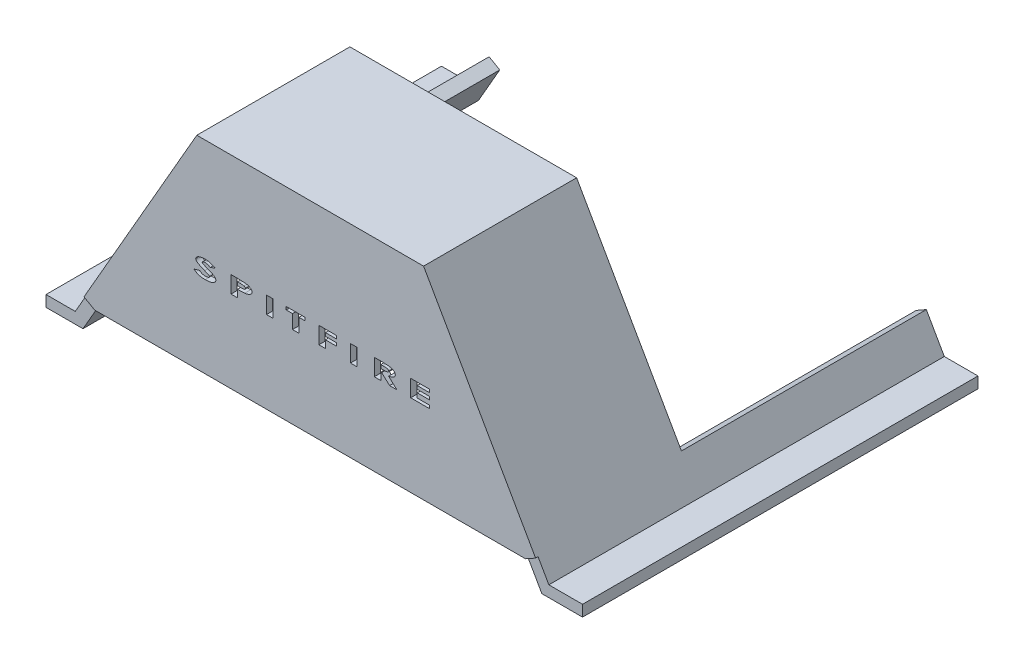
from build123d import *

# Parameters (mm, degrees)
BOSS_EXTRUDE1_DEPTH      = 30.48
BOSS_EXTRUDE4_DEPTH      = 1.27
BOSS_EXTRUDE5_DEPTH      = 50.8
BOSS_EXTRUDE5_DEPTH_BACK = 31.242
SKETCH9_W                = 1.346153846
SKETCH9_H                = 3.5
CUT_EXTRUDE3_DEPTH       = 50.8


with BuildPart() as part:
    # Sketch1 → Boss-Extrude1 (new body)
    with BuildSketch(Plane.XY):
        Polygon((-44.853816772, -1.588616625), (-47.056176074, -0.323225973), (-23.646449013, 40.420421126), (23.390422723, 40.420421126), (46.634567898, -0.417916439), (44.533134042, -1.588616625), (21.917209006, 38.145982087), (-22.076785037, 38.053850823), align=None)
    extrude(amount=BOSS_EXTRUDE1_DEPTH)

    # Sketch7 → Boss-Extrude4 (add)
    with BuildSketch(Plane.XY.offset(30.48)):
        Polygon((-23.646449013, 40.420421126), (-47.056176074, -0.323225973), (-44.853816772, -1.588616625), (44.533134042, -1.588616625), (46.634567898, -0.417916439), (23.390422723, 40.420421126), align=None)
    extrude(amount=BOSS_EXTRUDE4_DEPTH)

    # Sketch8 → Boss-Extrude5 (add, two sides: drawn at the far end of the back side and taken through both)
    with BuildSketch(Plane(origin=(0, 0, 0), x_dir=(-1, 0, 0), z_dir=(0, 0, -1)).offset(-BOSS_EXTRUDE5_DEPTH_BACK)):
        Polygon((-43.047620869, 1.021326136), (-47.422678524, -6.665344208), (-55.860841837, -6.665344208), (-55.860841837, -4.351490918), (-48.873458649, -4.351490918), (-45.138142651, 2.211198072), align=None)
        Polygon((43.354244396, 1.021326136), (47.770708497, -6.665344208), (55.445633406, -6.665344208), (55.445633406, -4.351490918), (49.370661635, -4.351490918), (45.556603699, 2.286716788), align=None)
    extrude(amount=BOSS_EXTRUDE5_DEPTH + BOSS_EXTRUDE5_DEPTH_BACK)

    # Sketch9 → Cut-Extrude3 (cut)
    # profile 1 of 8: a face of its own
    with BuildSketch(Plane.XY.offset(31.75)):
        with BuildLine():
            Line((-19.880975332, 18.460355703), (-20.870258184, 18.030568043))
            add(Edge.make_bspline(
                [(-20.870258184, 18.030568043), (-20.913350949, 18.059220564), (-20.99810049, 18.115570814), (-21.129718016, 18.188377739), (-21.26172595, 18.250504339), (-21.394406873, 18.301041619), (-21.527688025, 18.34085139), (-21.661617608, 18.368660986), (-21.796201846, 18.386318609), (-21.886130388, 18.388468429), (-21.93105546, 18.389542402)],
                knots=[0, 0, 0, 0, 1.091683427, 2.14698847, 3.170740019, 4.168220952, 5.140410702, 6.102843859, 7.052248899, 8, 8, 8, 8], degree=3))
            add(Edge.make_bspline(
                [(-21.93105546, 18.389542402), (-21.972926765, 18.388864571), (-22.052931094, 18.387569425), (-22.167058029, 18.374335419), (-22.269331205, 18.352195427), (-22.358122668, 18.322248083), (-22.430465051, 18.286699348), (-22.484700319, 18.249356661), (-22.520965181, 18.207154752), (-22.52607062, 18.17501169), (-22.528411229, 18.160275575)],
                knots=[0, 0, 0, 0, 1.475665859, 2.819583916, 4.043032172, 5.158235078, 6.116265948, 6.87105205, 7.482429282, 8, 8, 8, 8], degree=3))
            add(Edge.make_bspline(
                [(-22.528411229, 18.160275575), (-22.526809738, 18.145494535), (-22.523444341, 18.114433438), (-22.497442151, 18.070787044), (-22.458551509, 18.028640284), (-22.424761273, 18.005351373), (-22.406416037, 17.992707466)],
                knots=[0, 0, 0, 0, 0.819622474, 1.722366869, 2.763438082, 4, 4, 4, 4], degree=3))
            add(Edge.make_bspline(
                [(-22.406416037, 17.992707466), (-22.398733564, 17.987982981), (-22.381691653, 17.977502727), (-22.353155159, 17.961609231), (-22.319156154, 17.944041502), (-22.280042976, 17.924571574), (-22.235845779, 17.902892048), (-22.186788146, 17.878745272), (-22.132031181, 17.85391009), (-22.072309396, 17.826335245), (-22.00740461, 17.796966836), (-21.936936602, 17.766157503), (-21.8615805, 17.733131539), (-21.78041785, 17.699007404), (-21.694724411, 17.661588433), (-21.603343424, 17.62334488), (-21.507321278, 17.582281691), (-21.441239475, 17.555125308), (-21.407317479, 17.54118503)],
                knots=[0, 0, 0, 0, 0.394591831, 0.875317019, 1.428744126, 2.068985557, 2.786985155, 3.582766354, 4.461240374, 5.417565304, 6.461056227, 7.578254218, 8.782696337, 10.060972385, 11.430553475, 12.873997364, 14.395318445, 16, 16, 16, 16], degree=3))
            add(Edge.make_bspline(
                [(-21.407317479, 17.54118503), (-21.37552127, 17.528126566), (-21.313774949, 17.502767816), (-21.223723669, 17.465220892), (-21.138188623, 17.430493364), (-21.057377545, 17.396710649), (-20.981618384, 17.364460419), (-20.91013464, 17.335030411), (-20.844050547, 17.307087384), (-20.782520034, 17.281062893), (-20.726104835, 17.256428946), (-20.673958811, 17.23435843), (-20.627240116, 17.212673186), (-20.584417431, 17.195169272), (-20.546948758, 17.177967705), (-20.514287008, 17.16265426), (-20.486221128, 17.149374496), (-20.469210227, 17.141091244), (-20.461504178, 17.137338876)],
                knots=[0, 0, 0, 0, 1.604118552, 3.115101475, 4.553115034, 5.9122415, 7.202585794, 8.39559687, 9.519820201, 10.550938037, 11.513315234, 12.392630884, 13.193279978, 13.916493199, 14.551045555, 15.117032353, 15.600009878, 16, 16, 16, 16], degree=3))
            add(Edge.make_bspline(
                [(-20.461504178, 17.137338876), (-20.428234884, 17.12043728), (-20.363635317, 17.087619157), (-20.271341407, 17.037433565), (-20.186564806, 16.987560897), (-20.109847903, 16.9375361), (-20.039269759, 16.889879732), (-19.977244092, 16.841059627), (-19.922798491, 16.792966323), (-19.874860012, 16.745552948), (-19.833932358, 16.697612263), (-19.798850505, 16.648896459), (-19.768013656, 16.599980836), (-19.74431098, 16.548864837), (-19.725285844, 16.496806169), (-19.710918976, 16.443648722), (-19.703332396, 16.389228133), (-19.702103743, 16.352803974), (-19.701488152, 16.334554421)],
                knots=[0, 0, 0, 0, 1.536906611, 2.984238323, 4.326373644, 5.586618935, 6.756104581, 7.832517382, 8.834942139, 9.747009273, 10.607321378, 11.427550574, 12.218332473, 12.984778602, 13.743020709, 14.499488863, 15.248200689, 16, 16, 16, 16], degree=3))
            add(Edge.make_bspline(
                [(-19.701488152, 16.334554421), (-19.703367341, 16.29905579), (-19.70710187, 16.228509037), (-19.737667453, 16.12568688), (-19.785652014, 16.0275813), (-19.854986171, 15.935653028), (-19.942410983, 15.848467946), (-20.048388949, 15.765367022), (-20.174533602, 15.688984961), (-20.317402799, 15.616545665), (-20.475838634, 15.551577217), (-20.646698923, 15.493867245), (-20.829455248, 15.445714848), (-21.023868915, 15.406894463), (-21.229787755, 15.376144624), (-21.447346505, 15.353879377), (-21.676609335, 15.340394783), (-21.833347062, 15.338982708), (-21.913527415, 15.338260351)],
                knots=[0, 0, 0, 0, 0.646385066, 1.284566943, 1.940314228, 2.629139466, 3.37359924, 4.187084222, 5.078978625, 6.058787198, 7.106032266, 8.199181731, 9.345771339, 10.550346682, 11.81323771, 13.141607533, 14.537768023, 16, 16, 16, 16], degree=3))
            add(Edge.make_bspline(
                [(-21.913527415, 15.338260351), (-21.976638198, 15.338778509), (-22.100813817, 15.339798029), (-22.284136006, 15.348455387), (-22.461172344, 15.362222355), (-22.632125461, 15.38189701), (-22.796803156, 15.40698352), (-22.955417091, 15.437752363), (-23.107720207, 15.474182831), (-23.254081508, 15.516123529), (-23.394680314, 15.564698013), (-23.530074711, 15.619184271), (-23.660110878, 15.680481573), (-23.78539464, 15.747644502), (-23.905012874, 15.822362954), (-24.020543147, 15.902023171), (-24.130205995, 15.989163366), (-24.19906929, 16.052066225), (-24.233539434, 16.083552819)],
                knots=[0, 0, 0, 0, 1.212376337, 2.385449449, 3.524910045, 4.623147933, 5.690557158, 6.724301457, 7.726168706, 8.698122704, 9.648018407, 10.582639142, 11.500513003, 12.408516847, 13.311813064, 14.208558011, 15.103277532, 16, 16, 16, 16], degree=3))
            Line((-24.233539434, 16.083552819), (-23.080194082, 16.415183428))
            add(Edge.make_bspline(
                [(-23.080194082, 16.415183428), (-23.036631216, 16.379325982), (-22.950606198, 16.308517111), (-22.812168424, 16.217200851), (-22.668976936, 16.139925633), (-22.520981955, 16.076341103), (-22.368163921, 16.027041864), (-22.210437177, 15.992106131), (-22.047815181, 15.970376571), (-21.93766704, 15.967778862), (-21.881976934, 15.966465479)],
                knots=[0, 0, 0, 0, 1.034804767, 2.043462854, 3.037426323, 4.017263339, 4.995118027, 5.979412361, 6.978405458, 8, 8, 8, 8], degree=3))
            add(Edge.make_bspline(
                [(-21.881976934, 15.966465479), (-21.825356934, 15.967550798), (-21.716449681, 15.969638383), (-21.560440357, 15.988939088), (-21.417916807, 16.018846654), (-21.310334306, 16.056285784), (-21.23339077, 16.090439642), (-21.184427651, 16.116967263), (-21.142375853, 16.144030136), (-21.108490591, 16.173066937), (-21.081239416, 16.202357212), (-21.06160644, 16.23306707), (-21.049597384, 16.265213998), (-21.048286877, 16.287251706), (-21.047641998, 16.298096088)],
                knots=[0, 0, 0, 0, 2.126093077, 4.089490566, 5.895944197, 7.586824082, 8.357016622, 9.056292207, 9.677216458, 10.231434858, 10.728695353, 11.174462682, 11.593767083, 12, 12, 12, 12], degree=3))
            add(Edge.make_bspline(
                [(-21.047641998, 16.298096088), (-21.050041745, 16.318377249), (-21.055149871, 16.361547929), (-21.093336725, 16.422988412), (-21.151893265, 16.482071838), (-21.216567303, 16.530701237), (-21.283440933, 16.57067086), (-21.348946029, 16.606420123), (-21.427991588, 16.646143469), (-21.520799818, 16.689349423), (-21.626865925, 16.737133998), (-21.746497826, 16.788883324), (-21.879889368, 16.84410124), (-21.973330483, 16.881960902), (-22.022201293, 16.901761953)],
                knots=[0, 0, 0, 0, 0.613960841, 1.306883093, 2.14033392, 3.138385981, 3.753166967, 4.506066636, 5.404456802, 6.439656582, 7.615187789, 8.937798208, 10.39843219, 12, 12, 12, 12], degree=3))
            add(Edge.make_bspline(
                [(-22.022201293, 16.901761953), (-22.069909127, 16.920847977), (-22.16335211, 16.958230831), (-22.299744114, 17.014323713), (-22.429938064, 17.068499896), (-22.553753179, 17.120668846), (-22.670815392, 17.172221589), (-22.78163397, 17.220924314), (-22.885605159, 17.268696006), (-22.983022889, 17.315315112), (-23.074804528, 17.358904775), (-23.159479545, 17.40179729), (-23.237775741, 17.442698547), (-23.309823022, 17.481465462), (-23.374971516, 17.519634821), (-23.434162561, 17.555180139), (-23.486515222, 17.589369589), (-23.546740902, 17.631784057), (-23.612086707, 17.684601346), (-23.682520705, 17.747220044), (-23.74069673, 17.811318452), (-23.789283591, 17.87485191), (-23.827465085, 17.938389569), (-23.854834533, 18.002203549), (-23.870870822, 18.066241677), (-23.873343996, 18.109010904), (-23.874565075, 18.130127338)],
                knots=[0, 0, 0, 0, 1.60114733, 3.136088344, 4.595380943, 5.995318612, 7.322605221, 8.581101573, 9.767225937, 10.887801919, 11.946391758, 12.933211806, 13.845265137, 14.699053723, 15.482214252, 16.197861636, 16.850282063, 17.430187058, 18.492452784, 19.466806439, 20.363761661, 21.185228058, 21.955827715, 22.667275756, 23.341994581, 24, 24, 24, 24], degree=3))
            add(Edge.make_bspline(
                [(-23.874565075, 18.130127338), (-23.872715892, 18.160223333), (-23.8690206, 18.220365283), (-23.841685661, 18.308691742), (-23.796405939, 18.392666391), (-23.734312894, 18.473767402), (-23.653583734, 18.549768663), (-23.556799624, 18.623922444), (-23.44181235, 18.693250587), (-23.311482753, 18.759224911), (-23.168240824, 18.819370536), (-23.0153827, 18.872695793), (-22.85394974, 18.917474652), (-22.684722759, 18.95444053), (-22.507085174, 18.983260126), (-22.321492076, 19.003256008), (-22.127529283, 19.015272552), (-21.995576064, 19.016911372), (-21.928250973, 19.01774753)],
                knots=[0, 0, 0, 0, 0.625271997, 1.249504346, 1.903883601, 2.600822939, 3.363848494, 4.202719198, 5.132086019, 6.151445453, 7.238214692, 8.360218229, 9.515790205, 10.719770275, 11.960577907, 13.256149918, 14.600034489, 16, 16, 16, 16], degree=3))
            add(Edge.make_bspline(
                [(-21.928250973, 19.01774753), (-21.841029264, 19.016243321), (-21.668166401, 19.01326216), (-21.412263195, 18.990166513), (-21.162559675, 18.953417018), (-20.958608799, 18.909162024), (-20.796551676, 18.865490207), (-20.672885762, 18.825943989), (-20.546981528, 18.780207533), (-20.418097623, 18.729167219), (-20.287331815, 18.670467284), (-20.153351529, 18.606940098), (-20.017234408, 18.536829872), (-19.926862959, 18.486109717), (-19.880975332, 18.460355703)],
                knots=[0, 0, 0, 0, 1.461251088, 2.896022701, 4.301560376, 5.687913366, 6.389912649, 7.113149984, 7.86255408, 8.634068102, 9.435222983, 10.263702903, 11.118365876, 12, 12, 12, 12], degree=3))
        make_face()
    # profile 2 of 8: a face of its own
    with BuildSketch(Plane.XY.offset(31.75)):
        with BuildLine():
            Line((-16.555975332, 18.92800394), (-15.076608344, 18.92800394))
            add(Edge.make_bspline(
                [(-15.076608344, 18.92800394), (-14.980085356, 18.927801938), (-14.794036835, 18.927412578), (-14.52547173, 18.9225797), (-14.277960661, 18.914081233), (-14.051188992, 18.903331454), (-13.845491709, 18.888602234), (-13.660499696, 18.87148197), (-13.496502749, 18.850870377), (-13.351000493, 18.8261936), (-13.219541601, 18.797164362), (-13.096779629, 18.76658478), (-12.981907883, 18.729273723), (-12.873190116, 18.690870627), (-12.772271997, 18.646030154), (-12.677402762, 18.599038409), (-12.59011944, 18.546803419), (-12.510153301, 18.491137614), (-12.438870309, 18.431538538), (-12.37546472, 18.369996933), (-12.322765179, 18.30424306), (-12.278711129, 18.23611932), (-12.244719303, 18.164722327), (-12.220600506, 18.090274081), (-12.206397092, 18.012880938), (-12.204410675, 17.960279256), (-12.203411229, 17.933813235)],
                knots=[0, 0, 0, 0, 2.103967718, 4.055407821, 5.854732046, 7.502206269, 9.003744298, 10.349582875, 11.551404248, 12.605824473, 13.565067824, 14.485571486, 15.36202681, 16.196807217, 16.997519254, 17.767566775, 18.503193987, 19.212673755, 19.889064672, 20.526665875, 21.135300666, 21.721764219, 22.291437402, 22.85368214, 23.423241423, 24, 24, 24, 24], degree=3))
            add(Edge.make_bspline(
                [(-12.203411229, 17.933813235), (-12.204616899, 17.904504138), (-12.207005885, 17.846429355), (-12.226385426, 17.761290074), (-12.259470549, 17.680638223), (-12.30404621, 17.603143101), (-12.362257318, 17.530067094), (-12.433320699, 17.461157268), (-12.51646395, 17.395790163), (-12.612371418, 17.33536272), (-12.718334518, 17.278385037), (-12.833958447, 17.225505947), (-12.959021435, 17.178266866), (-13.092914453, 17.134966747), (-13.235835845, 17.095617129), (-13.387649663, 17.060823111), (-13.548766079, 17.030365357), (-13.659567303, 17.014878366), (-13.716432062, 17.006930222)],
                knots=[0, 0, 0, 0, 0.732453356, 1.451326549, 2.169795739, 2.905599173, 3.679636619, 4.497949757, 5.376045391, 6.319619557, 7.329010129, 8.382982248, 9.496631271, 10.670269818, 11.90101886, 13.202505914, 14.564286372, 16, 16, 16, 16], degree=3))
            add(Edge.make_bspline(
                [(-13.716432062, 17.006930222), (-13.754032675, 17.00245756), (-13.836100528, 16.992695436), (-13.970393677, 16.982984537), (-14.125589102, 16.973941034), (-14.301816766, 16.966175816), (-14.498864031, 16.960934658), (-14.717152978, 16.956785425), (-14.956474773, 16.953810299), (-15.123115111, 16.95370155), (-15.209821485, 16.953644966)],
                knots=[0, 0, 0, 0, 0.607774946, 1.32654179, 2.160829462, 3.103391361, 4.158025334, 5.324998049, 6.608141801, 8, 8, 8, 8], degree=3))
            Line((-15.209821485, 16.953644966), (-15.209821485, 15.42800394))
            Line((-15.209821485, 15.42800394), (-16.555975332, 15.42800394))
            Line((-16.555975332, 15.42800394), (-16.555975332, 18.92800394))
        make_face()
        with BuildLine():
            Line((-15.209821485, 17.581850094), (-14.752690075, 17.581850094))
            add(Edge.make_bspline(
                [(-14.752690075, 17.581850094), (-14.709454017, 17.582042178), (-14.626251669, 17.582411819), (-14.506816399, 17.583606265), (-14.397422912, 17.586318153), (-14.298573597, 17.59068028), (-14.209711202, 17.595210577), (-14.131434308, 17.601713674), (-14.063317627, 17.608262545), (-13.988011895, 17.619273049), (-13.905489665, 17.636738244), (-13.816310086, 17.662734827), (-13.738341341, 17.694973762), (-13.671832989, 17.732433131), (-13.617786468, 17.775315638), (-13.578353158, 17.823860629), (-13.554075172, 17.877757442), (-13.551069249, 17.915585217), (-13.549565075, 17.934514357)],
                knots=[0, 0, 0, 0, 1.538675383, 2.960986962, 4.25055778, 5.43263165, 6.48219499, 7.416706439, 8.227735388, 8.916996975, 10.124086151, 11.226619887, 12.218268115, 13.119890787, 13.935639634, 14.657834848, 15.328376269, 16, 16, 16, 16], degree=3))
            add(Edge.make_bspline(
                [(-13.549565075, 17.934514357), (-13.550724709, 17.950987665), (-13.553013799, 17.983505586), (-13.569010296, 18.030619426), (-13.596896692, 18.073338604), (-13.634511092, 18.112977143), (-13.683352906, 18.148004333), (-13.742484952, 18.179375885), (-13.81166006, 18.208131045), (-13.862324069, 18.222728376), (-13.888908024, 18.230387755)],
                knots=[0, 0, 0, 0, 0.815139586, 1.609066351, 2.430748093, 3.322803906, 4.299316961, 5.391643318, 6.63136692, 8, 8, 8, 8], degree=3))
            add(Edge.make_bspline(
                [(-13.888908024, 18.230387755), (-13.911513345, 18.236065921), (-13.961034093, 18.248504898), (-14.042910954, 18.261616085), (-14.137614029, 18.273491141), (-14.245428257, 18.283150449), (-14.366302113, 18.290596187), (-14.50046967, 18.296363957), (-14.64774813, 18.298660723), (-14.750352882, 18.299408677), (-14.803871966, 18.299798812)],
                knots=[0, 0, 0, 0, 0.608022516, 1.331975314, 2.161864864, 3.098935154, 4.156220966, 5.322182303, 6.603238643, 8, 8, 8, 8], degree=3))
            Line((-14.803871966, 18.299798812), (-15.209821485, 18.299798812))
            Line((-15.209821485, 18.299798812), (-15.209821485, 17.581850094))
        make_face(mode=Mode.SUBTRACT)
    # profile 3 of 8: a face of its own
    with BuildSketch(Plane.XY.offset(31.75)):
        with Locations((-8.51943687, 17.17800394)):
            Rectangle(SKETCH9_W, SKETCH9_H)
    # profile 4 of 8: a face of its own
    with BuildSketch(Plane.XY.offset(31.75)):
        Polygon((-5.10469328, 18.92800394), (-1.155975332, 18.92800394), (-1.155975332, 18.299798812), (-2.457257383, 18.299798812), (-2.457257383, 15.42800394), (-3.803411229, 15.42800394), (-3.803411229, 18.299798812), (-5.10469328, 18.299798812), align=None)
    # profile 5 of 8: a face of its own
    with BuildSketch(Plane.XY.offset(31.75)):
        Polygon((1.675434925, 18.92800394), (5.310050309, 18.92800394), (5.310050309, 18.299798812), (3.021588771, 18.299798812), (3.021588771, 17.626721889), (5.310050309, 17.626721889), (5.310050309, 16.998516761), (3.021588771, 16.998516761), (3.021588771, 15.42800394), (1.675434925, 15.42800394), align=None)
    # profile 6 of 8: a face of its own
    with BuildSketch(Plane.XY.offset(31.75)):
        with Locations((8.904281079, 17.17800394)):
            Rectangle(SKETCH9_W, SKETCH9_H)
    # profile 7 of 8: a face of its own
    with BuildSketch(Plane.XY.offset(31.75)):
        with BuildLine():
            Line((13.171588771, 18.92800394), (14.650955758, 18.92800394))
            add(Edge.make_bspline(
                [(14.650955758, 18.92800394), (14.700735103, 18.927738815), (14.798424188, 18.927218522), (14.942163299, 18.926987075), (15.080282569, 18.924602613), (15.213032697, 18.921903352), (15.340168635, 18.918320964), (15.461960715, 18.914477192), (15.578301926, 18.908291694), (15.689376401, 18.90332801), (15.794755493, 18.896007426), (15.894557975, 18.888365583), (15.988987986, 18.880002196), (16.078043975, 18.870933662), (16.16172095, 18.861106686), (16.239802642, 18.850691274), (16.312582506, 18.839669033), (16.400995945, 18.822769808), (16.50558417, 18.800238465), (16.625217693, 18.768942155), (16.738468971, 18.733120069), (16.845262521, 18.693264915), (16.945856322, 18.648895859), (17.040488168, 18.600931819), (17.128482631, 18.54807595), (17.209728962, 18.491614086), (17.283029582, 18.431778993), (17.34782294, 18.369272779), (17.401814828, 18.303158207), (17.446706627, 18.234738855), (17.481456835, 18.163363959), (17.505987617, 18.089336425), (17.521477309, 18.012513792), (17.523252553, 17.960295782), (17.524152874, 17.933813235)],
                knots=[0, 0, 0, 0, 1.447747822, 2.841121361, 4.180258665, 5.46515348, 6.702649317, 7.87921363, 9.008802404, 10.090870714, 11.112663307, 12.080709401, 13.001903797, 13.869615965, 14.68402087, 15.452066414, 16.160539564, 16.824409067, 18.069589957, 19.271424528, 20.419309892, 21.522685964, 22.58478148, 23.615263057, 24.606067619, 25.567697667, 26.490195027, 27.35534788, 28.181243678, 28.967391338, 29.730397892, 30.482672798, 31.23048221, 32, 32, 32, 32], degree=3))
            add(Edge.make_bspline(
                [(17.524152874, 17.933813235), (17.523062162, 17.90615274), (17.520907981, 17.851522596), (17.504114815, 17.771564161), (17.477507153, 17.694929271), (17.438849381, 17.621962002), (17.389582098, 17.552672414), (17.329643017, 17.486767922), (17.259384795, 17.424141225), (17.177083342, 17.366445534), (17.085207908, 17.310525444), (16.981412821, 17.260151615), (16.867797725, 17.211234245), (16.742361965, 17.167756952), (16.606544316, 17.126336104), (16.459594288, 17.088666571), (16.301965961, 17.054290449), (16.192797056, 17.035055308), (16.136632841, 17.025159389)],
                knots=[0, 0, 0, 0, 0.738510582, 1.4585762, 2.173479213, 2.89966467, 3.656763107, 4.439287494, 5.275198475, 6.165849881, 7.121074261, 8.14592728, 9.245426128, 10.424461814, 11.690624821, 13.03852549, 14.476407813, 16, 16, 16, 16], degree=3))
            Line((16.136632841, 17.025159389), (17.860691335, 15.42800394))
            Line((17.860691335, 15.42800394), (16.344866015, 15.42800394))
            Line((16.344866015, 15.42800394), (14.697930918, 16.953644966))
            Line((14.697930918, 16.953644966), (14.517742617, 16.953644966))
            Line((14.517742617, 16.953644966), (14.517742617, 15.42800394))
            Line((14.517742617, 15.42800394), (13.171588771, 15.42800394))
            Line((13.171588771, 15.42800394), (13.171588771, 18.92800394))
        make_face()
        with BuildLine():
            Line((14.517742617, 17.581850094), (14.969966175, 17.581850094))
            add(Edge.make_bspline(
                [(14.969966175, 17.581850094), (15.025121531, 17.582190623), (15.131003409, 17.582844338), (15.283209994, 17.585800764), (15.422045895, 17.593071528), (15.54734502, 17.60206027), (15.659495888, 17.61262769), (15.757905867, 17.627487425), (15.843291374, 17.643708665), (15.915957345, 17.663453418), (15.978024016, 17.685905387), (16.031214394, 17.711614897), (16.07602208, 17.741591716), (16.113874851, 17.773999408), (16.142476184, 17.811487145), (16.163204865, 17.851767348), (16.17564145, 17.89593351), (16.177197505, 17.926488078), (16.177999027, 17.942226697)],
                knots=[0, 0, 0, 0, 1.941146161, 3.726423238, 5.35702916, 6.833163903, 8.147527669, 9.320030401, 10.334631107, 11.204606299, 11.967041687, 12.654891231, 13.277652523, 13.860286715, 14.399880292, 14.925888225, 15.446726421, 16, 16, 16, 16], degree=3))
            add(Edge.make_bspline(
                [(16.177999027, 17.942226697), (16.176622608, 17.960981135), (16.173833575, 17.998983193), (16.146724982, 18.052285239), (16.105168678, 18.101243366), (16.047660598, 18.144196029), (15.978028414, 18.183202277), (15.896826278, 18.216776201), (15.804620835, 18.243609603), (15.719454603, 18.261115648), (15.641527864, 18.271795083), (15.57071168, 18.279590155), (15.488834515, 18.285426748), (15.395603456, 18.291316908), (15.291104424, 18.29524274), (15.175175712, 18.298064415), (15.048260246, 18.299233496), (14.959916797, 18.299605133), (14.913876431, 18.299798812)],
                knots=[0, 0, 0, 0, 0.635787271, 1.288293716, 1.995563529, 2.813518098, 3.720151647, 4.71346607, 5.80296468, 6.991050822, 7.675307862, 8.485143574, 9.420510408, 10.47461831, 11.671230475, 12.986838517, 14.42968486, 16, 16, 16, 16], degree=3))
            Line((14.913876431, 18.299798812), (14.517742617, 18.299798812))
            Line((14.517742617, 18.299798812), (14.517742617, 17.581850094))
        make_face(mode=Mode.SUBTRACT)
    # profile 8 of 8: a face of its own
    with BuildSketch(Plane.XY.offset(31.75)):
        Polygon((20.714537489, 18.92800394), (24.663255438, 18.92800394), (24.663255438, 18.299798812), (22.060691335, 18.299798812), (22.060691335, 17.626721889), (24.663255438, 17.626721889), (24.663255438, 16.998516761), (22.060691335, 16.998516761), (22.060691335, 16.056209069), (24.663255438, 16.056209069), (24.663255438, 15.42800394), (20.714537489, 15.42800394), align=None)
    extrude(amount=-CUT_EXTRUDE3_DEPTH, mode=Mode.SUBTRACT)


with BuildPart() as cut_extrude3_piece_1:
    # of the separate pieces the step leaves, piece 1, a body of its own (cut_extrude3_pieces)
    add(part.part.solids().sort_by_distance((-49.370661635, -4.351490918, -50.8))[0])


with BuildPart() as cut_extrude3_piece_2:
    # of the separate pieces the step leaves, piece 2, a body of its own (cut_extrude3_pieces)
    add(part.part.solids().sort_by_distance((14.517742617, 18.299798812, 31.75))[0])


with BuildPart() as cut_extrude3_piece_3:
    # of the separate pieces the step leaves, piece 3, a body of its own (cut_extrude3_pieces)
    add(part.part.solids().sort_by_distance((-15.209821485, 18.299798812, 31.75))[0])


solid = Compound([cut_extrude3_piece_1.part, cut_extrude3_piece_2.part, cut_extrude3_piece_3.part])
